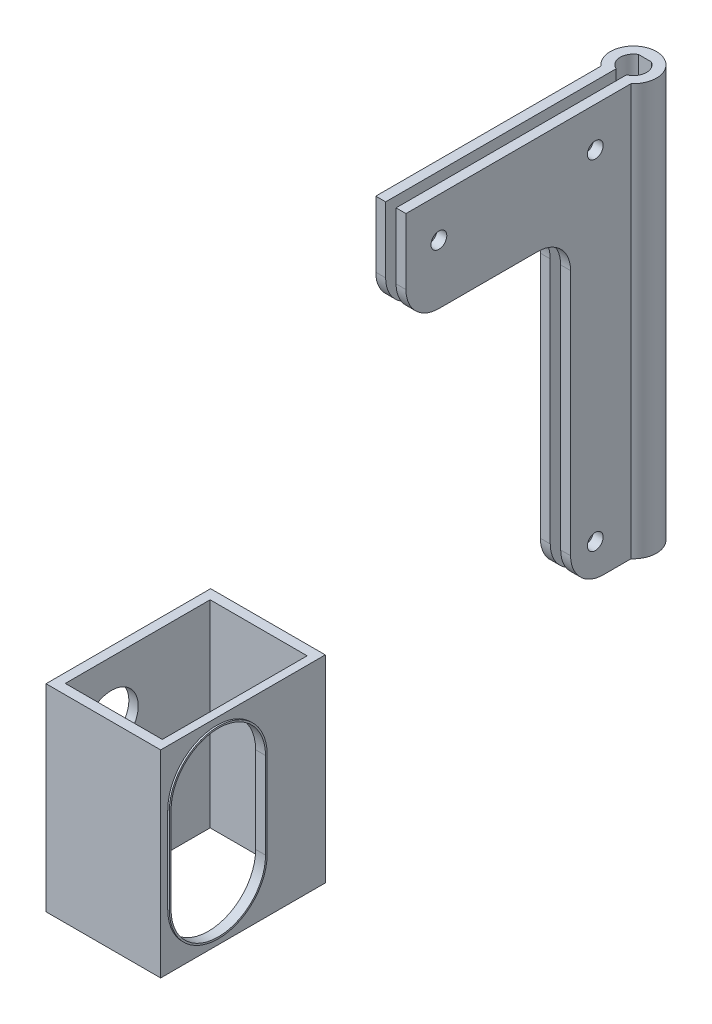
from build123d import *

# Parameters (mm, degrees)
BOSS_EXTRUDE1_DEPTH  = 125
SKETCH6_W            = 3
SKETCH6_H            = 50
BOSS_EXTRUDE3_DEPTH  = 30
FILLET6_R            = 10
M4_CLEARANCE_HOLE1_D = 4.8
SKETCH16_W           = 50
SKETCH16_H           = 60
SKETCH16_R           = 8.15
BOSS_EXTRUDE9_DEPTH  = 2.85
SKETCH19_W           = 2.5
SKETCH19_H           = 60
BOSS_EXTRUDE11_DEPTH = 31.975
SKETCH20_W           = 2.5
SKETCH20_H           = 50
BOSS_EXTRUDE12_DEPTH = 60
CUT_EXTRUDE3_DEPTH   = 2.5
BOSS_EXTRUDE13_DEPTH = 0.5
BOSS_EXTRUDE10_START = -60
SKETCH18_W           = 34.825
SKETCH18_H           = 3
BOSS_EXTRUDE10_DEPTH = 60


with BuildPart() as part:
    # Sketch1 → Boss-Extrude1 (new body)
    with BuildSketch(Plane(origin=(0, 0, 0), x_dir=(1, 0, 0), z_dir=(0, 1, 0))):
        with BuildLine():
            Line((-1.5875, -3.671490671), (-1.5875, -23.671490671))
            Line((-1.5875, -23.671490671), (-4.5875, -23.671490671))
            Line((-4.5875, -23.671490671), (-4.5875, -5.287234036))
            ThreePointArc((-4.5875, -5.287234036), (0, 7), (4.5875, -5.287234036))
            Line((4.5875, -5.287234036), (4.5875, -23.671490671))
            Line((4.5875, -23.671490671), (1.5875, -23.671490671))
            Line((1.5875, -23.671490671), (1.5875, -3.671490671))
            ThreePointArc((1.5875, -3.671490671), (3.995272073, -0.194424946), (1.936491673, 3.5))
            Line((1.936491673, 3.5), (-1.936491673, 3.5))
            ThreePointArc((-1.936491673, 3.5), (-3.995272073, -0.194424946), (-1.5875, -3.671490671))
        make_face()
    extrude(amount=BOSS_EXTRUDE1_DEPTH)

    # Sketch6 → Boss-Extrude3 (add)
    with BuildSketch(Plane(origin=(0, 125, 0), x_dir=(1, 0, 0), z_dir=(0, 1, 0))):
        with Locations((3.0875, -48.671490671)):
            Rectangle(SKETCH6_W, SKETCH6_H)
        with Locations((-3.0875, -48.671490671)):
            Rectangle(SKETCH6_W, SKETCH6_H)
    extrude(amount=-BOSS_EXTRUDE3_DEPTH)

    # Fillet6
    fillet6_edges = [part.edges().sort_by_distance(p)[0] for p in [
        (-3.0875, 0, 23.671490671),
        (3.0875, 0, 23.671490671),
        (3.0875, 95, 23.671490671),
        (3.0875, 95, 73.671490671),
        (-3.0875, 95, 23.671490671),
        (-3.0875, 95, 73.671490671),
    ]]
    fillet(fillet6_edges, radius=FILLET6_R)

    # M4 Clearance Hole1 (through all)
    with Locations(Plane(origin=(4.5875, 0, 0), x_dir=(0, 0, -1), z_dir=(1, 0, 0))):
        with Locations((-16.171490671, 113), (-16.171490671, 10), (-63.671490671, 113)):
            Hole(M4_CLEARANCE_HOLE1_D / 2)


with BuildPart() as body_2:
    # Sketch16 → Boss-Extrude9 (new body)
    with BuildSketch(Plane.ZY.offset(36.4125)):
        with Locations((117, -15)):
            Rectangle(SKETCH16_W, SKETCH16_H)
        with Locations((125, -2)):
            Circle(SKETCH16_R, mode=Mode.SUBTRACT)
        with Locations((125, -28)):
            Circle(SKETCH16_R, mode=Mode.SUBTRACT)
        with BuildLine():
            Line((134.75, -11), (134.75, -19))
            ThreePointArc((134.75, -19), (132.5, -21.25), (130.25, -19))
            Line((130.25, -19), (130.25, -11))
            ThreePointArc((130.25, -11), (132.5, -8.75), (134.75, -11))
        make_face(mode=Mode.SUBTRACT)
        with BuildLine():
            Line((117.35, -10), (117.35, -20))
            ThreePointArc((117.35, -20), (116.35, -21), (115.35, -20))
            Line((115.35, -20), (115.35, -10))
            ThreePointArc((115.35, -10), (116.35, -9), (117.35, -10))
        make_face(mode=Mode.SUBTRACT)
    extrude(amount=-BOSS_EXTRUDE9_DEPTH)

    # Sketch19 → Boss-Extrude11 (add)
    with BuildSketch(Plane(origin=(-33.5625, 0, 0), x_dir=(0, 0, -1), z_dir=(1, 0, 0))):
        with Locations((-140.75, -15)):
            Rectangle(SKETCH19_W, SKETCH19_H)
        with Locations((-93.25, -15)):
            Rectangle(SKETCH19_W, SKETCH19_H)
    extrude(amount=BOSS_EXTRUDE11_DEPTH)

    # Sketch20 → Boss-Extrude12 (add)
    with BuildSketch(Plane.XZ.offset(45)):
        with Locations((-2.8375, 117)):
            Rectangle(SKETCH20_W, SKETCH20_H)
    extrude(amount=-BOSS_EXTRUDE12_DEPTH)

    # Sketch21<2> → Cut-Extrude3 (cut)
    with BuildSketch(Plane(origin=(-1.5875, 0, 0), x_dir=(0, 0, -1), z_dir=(1, 0, 0))):
        with BuildLine():
            Line((-110.65, -1.9), (-110.65, -28.1))
            ThreePointArc((-110.65, -28.1), (-125, -42.45), (-139.35, -28.1))
            Line((-139.35, -28.1), (-139.35, -1.9))
            ThreePointArc((-139.35, -1.9), (-125, 12.45), (-110.65, -1.9))
        make_face()
    extrude(amount=-CUT_EXTRUDE3_DEPTH, mode=Mode.SUBTRACT)

    # Sketch21 → Boss-Extrude13 (add)
    with BuildSketch(Plane(origin=(-1.5875, 0, 0), x_dir=(0, 0, -1), z_dir=(1, 0, 0))):
        with BuildLine():
            Line((-110.15, -1.9), (-110.15, -28.1))
            ThreePointArc((-110.15, -28.1), (-125, -42.95), (-139.85, -28.1))
            Line((-139.85, -28.1), (-139.85, -1.9))
            ThreePointArc((-139.85, -1.9), (-125, 12.95), (-110.15, -1.9))
        make_face()
        with BuildLine():
            Line((-110.65, -1.9), (-110.65, -28.1))
            ThreePointArc((-110.65, -28.1), (-125, -42.45), (-139.35, -28.1))
            Line((-139.35, -28.1), (-139.35, -1.9))
            ThreePointArc((-139.35, -1.9), (-125, 12.45), (-110.65, -1.9))
        make_face(mode=Mode.SUBTRACT)
    extrude(amount=BOSS_EXTRUDE13_DEPTH)

    # Sketch18 → Boss-Extrude10 (add)
    with BuildSketch(Plane.XZ.offset(45).offset(BOSS_EXTRUDE10_START)):
        with Locations((-19, 140.5)):
            Rectangle(SKETCH18_W, SKETCH18_H)
        with Locations((-19, 93.5)):
            Rectangle(SKETCH18_W, SKETCH18_H)
    extrude(amount=BOSS_EXTRUDE10_DEPTH)


solid = Compound([part.part, body_2.part])
